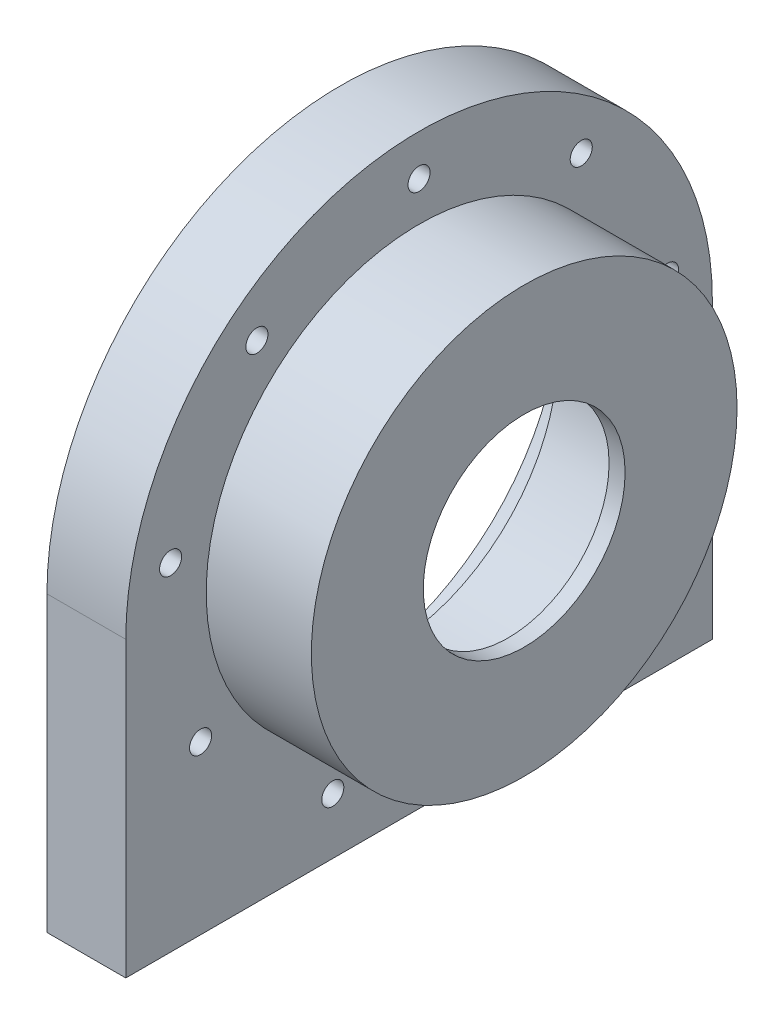
from build123d import *

# Parameters (mm, degrees)
SKETCH1_R           = 27
SKETCH1_R_2         = 1.750000056
SKETCH1_R_3         = 1.75
BOSS_EXTRUDE1_DEPTH = 12.5
SKETCH6_R           = 35
CUT_EXTRUDE3_DEPTH  = 7.5
SKETCH7_R           = 33.747750153
SKETCH7_R_2         = 27
BOSS_EXTRUDE4_DEPTH = 14.125838812
SKETCH8_R           = 33.747750153
SKETCH8_R_2         = 16
BOSS_EXTRUDE5_DEPTH = 2.54
SKETCH9_R           = 2.499999953
CUT_EXTRUDE4_DEPTH  = 5


with BuildPart() as part:
    # Sketch1 → Boss-Extrude1 (new body)
    with BuildSketch(Plane(origin=(0, 0, 0), x_dir=(0, 0, -1), z_dir=(1, 0, 0))):
        with BuildLine():
            Line((46.5, 0), (46.5, -46.5))
            Line((46.5, -46.5), (-46.5, -46.5))
            Line((-46.5, -46.5), (-46.5, 0))
            ThreePointArc((-46.5, 0), (0, 46.5), (46.5, 0))
        make_face()
        Circle(SKETCH1_R, mode=Mode.SUBTRACT)
        with Locations((15.5, 26.846787517)):
            Circle(SKETCH1_R_2, mode=Mode.SUBTRACT)
        with Locations((0, 31)):
            Circle(SKETCH1_R_2, mode=Mode.SUBTRACT)
        with Locations((-15.5, 26.846787517)):
            Circle(SKETCH1_R_2, mode=Mode.SUBTRACT)
        with Locations((-31, 0)):
            Circle(SKETCH1_R_2, mode=Mode.SUBTRACT)
        with Locations((-26.846787517, -15.5)):
            Circle(SKETCH1_R_2, mode=Mode.SUBTRACT)
        with Locations((-15.5, -26.846787517)):
            Circle(SKETCH1_R_2, mode=Mode.SUBTRACT)
        with Locations((0, -31)):
            Circle(SKETCH1_R_2, mode=Mode.SUBTRACT)
        with Locations((15.5, -26.846787517)):
            Circle(SKETCH1_R_2, mode=Mode.SUBTRACT)
        with Locations((26.846787517, -15.5)):
            Circle(SKETCH1_R_2, mode=Mode.SUBTRACT)
        with Locations((31, 0)):
            Circle(SKETCH1_R_2, mode=Mode.SUBTRACT)
        with Locations((26.846787517, 15.5)):
            Circle(SKETCH1_R_2, mode=Mode.SUBTRACT)
        with Locations((-26.846787517, 15.5)):
            Circle(SKETCH1_R_3, mode=Mode.SUBTRACT)
        with Locations((0, 40)):
            Circle(SKETCH1_R_3, mode=Mode.SUBTRACT)
        with Locations((25.711504387, 30.641777725)):
            Circle(SKETCH1_R_3, mode=Mode.SUBTRACT)
        with Locations((39.39231012, 6.945927107)):
            Circle(SKETCH1_R_3, mode=Mode.SUBTRACT)
        with Locations((34.641016151, -20)):
            Circle(SKETCH1_R_3, mode=Mode.SUBTRACT)
        with Locations((13.680805733, -37.587704831)):
            Circle(SKETCH1_R_3, mode=Mode.SUBTRACT)
        with Locations((-13.680805733, -37.587704831)):
            Circle(SKETCH1_R_3, mode=Mode.SUBTRACT)
        with Locations((-34.641016151, -20)):
            Circle(SKETCH1_R_3, mode=Mode.SUBTRACT)
        with Locations((-39.39231012, 6.945927107)):
            Circle(SKETCH1_R_3, mode=Mode.SUBTRACT)
        with Locations((-25.711504387, 30.641777725)):
            Circle(SKETCH1_R_3, mode=Mode.SUBTRACT)
    extrude(amount=BOSS_EXTRUDE1_DEPTH)

    # Sketch6 → Cut-Extrude3 (cut)
    with BuildSketch(Plane.ZY):
        Circle(SKETCH6_R)
    extrude(amount=-CUT_EXTRUDE3_DEPTH, mode=Mode.SUBTRACT)

    # Sketch7 → Boss-Extrude4 (add)
    with BuildSketch(Plane(origin=(12.5, 0, 0), x_dir=(0, 0, -1), z_dir=(1, 0, 0))):
        Circle(SKETCH7_R)
        with Locations(Location((0, 0, 0), (0, 0, 180))):
            Circle(SKETCH7_R_2, mode=Mode.SUBTRACT)
    extrude(amount=BOSS_EXTRUDE4_DEPTH)

    # Sketch8 → Boss-Extrude5 (add)
    with BuildSketch(Plane(origin=(26.625838812, 0, 0), x_dir=(0, 0, -1), z_dir=(1, 0, 0))):
        Circle(SKETCH8_R)
        Circle(SKETCH8_R_2, mode=Mode.SUBTRACT)
    extrude(amount=BOSS_EXTRUDE5_DEPTH)

    # Sketch9 → Cut-Extrude4 (cut)
    with BuildSketch(Plane.XZ.offset(46.5)):
        with Locations(Location((6.25, 37.338000036, 0), (0, 0, 270))):
            Circle(SKETCH9_R)
        with Locations(Location((6.25, 24.892000036, 0), (0, 0, 270))):
            Circle(SKETCH9_R)
        with Locations(Location((6.25, 12.446000036, 0), (0, 0, 270))):
            Circle(SKETCH9_R)
        with Locations(Location((6.25, 3.6e-08, 0), (0, 0, 270))):
            Circle(SKETCH9_R)
        with Locations(Location((6.25, -12.445999964, 0), (0, 0, 270))):
            Circle(SKETCH9_R)
        with Locations(Location((6.25, -24.891999964, 0), (0, 0, 270))):
            Circle(SKETCH9_R)
        with Locations(Location((6.25, -37.337999964, 0), (0, 0, 270))):
            Circle(SKETCH9_R)
    extrude(amount=-CUT_EXTRUDE4_DEPTH, mode=Mode.SUBTRACT)


solid = part.part
